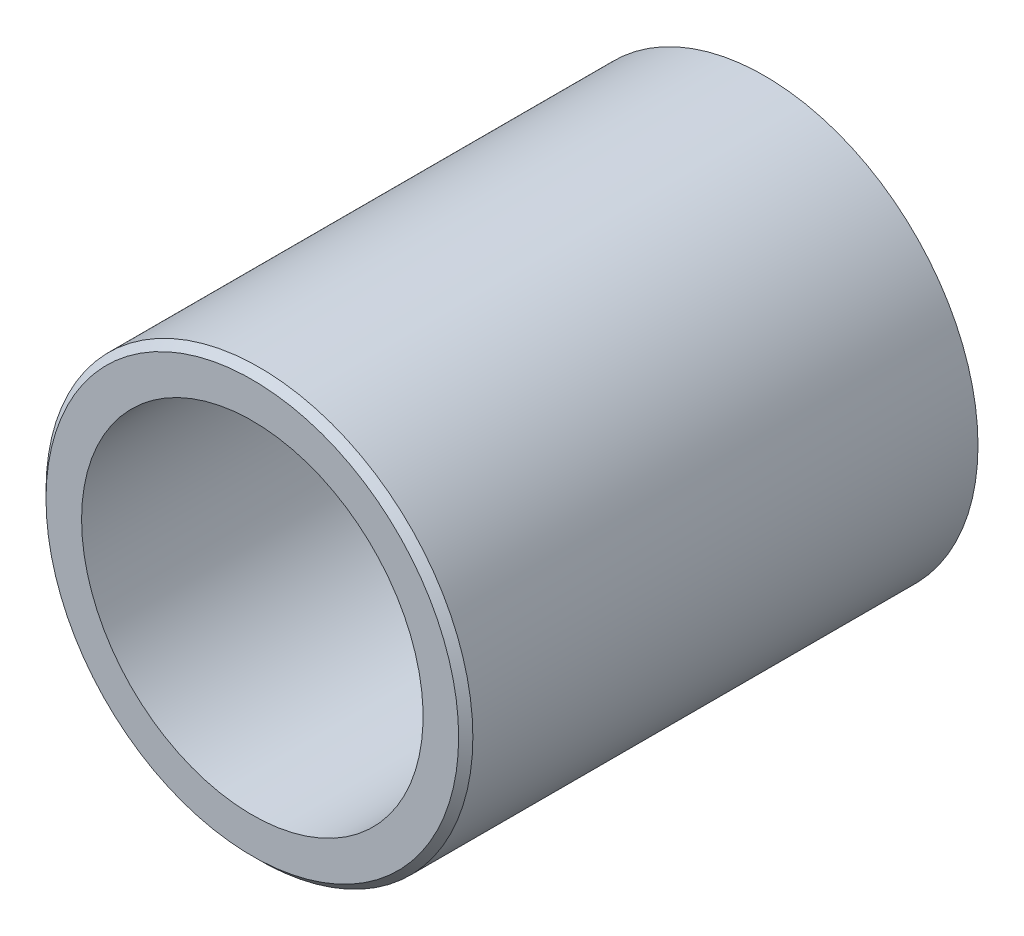
from build123d import *

# Parameters (mm, degrees)
SKETCH1_R      = 7.9375
SKETCH1_R_2    = 6.35
EXTRUDE1_DEPTH = 9.525
CHAMFER1_SIZE  = 0.264583333


with BuildPart() as part:
    # Sketch1 → Extrude1 (new, symmetric)
    with BuildSketch(Plane.XY):
        with Locations(Location((0, 0, 0), (0, 0, 180))):
            Circle(SKETCH1_R)
        with Locations(Location((0, 0, 0), (0, 0, 180))):
            Circle(SKETCH1_R_2, mode=Mode.SUBTRACT)
    extrude(amount=EXTRUDE1_DEPTH, both=True)

    # Chamfer1
    chamfer1_edges = [part.edges().sort_by_distance(p)[0] for p in [
        (7.9375, 0, 9.525),
    ]]
    chamfer(chamfer1_edges, length=CHAMFER1_SIZE)


solid = part.part
